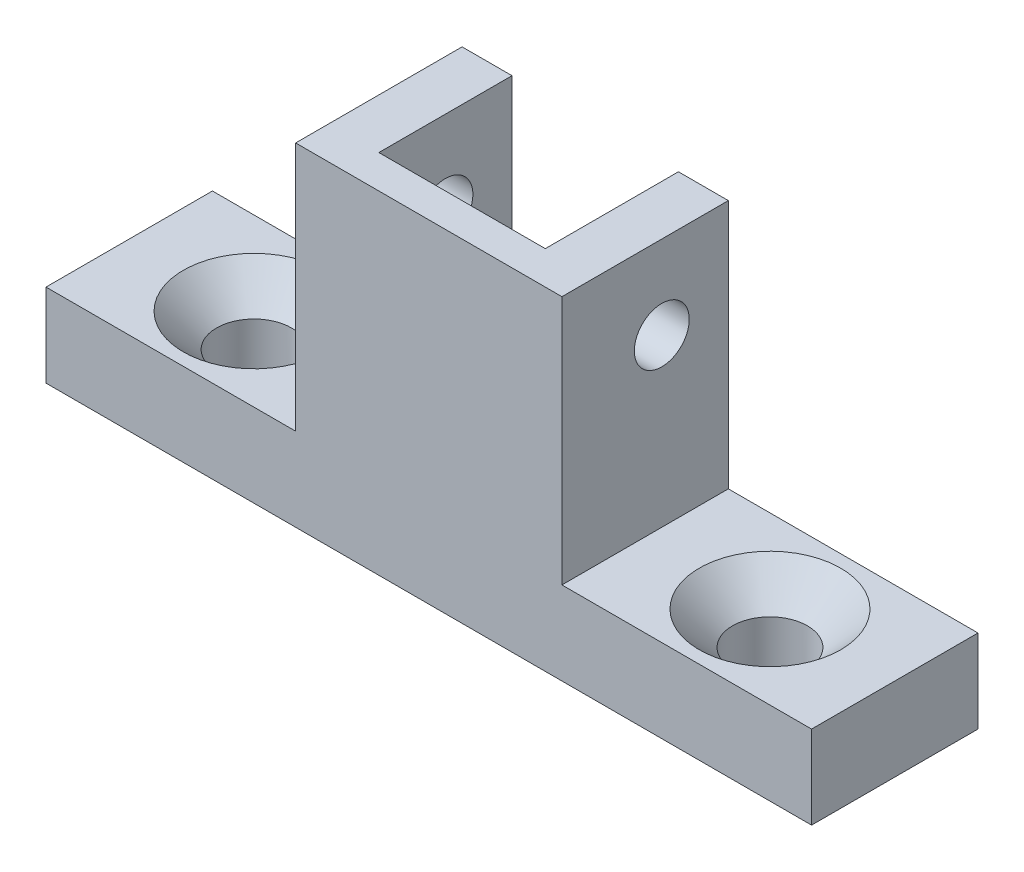
from build123d import *

# Parameters (mm, degrees)
BOSS_EXTRUDE1_DEPTH = 5
SKETCH2_R           = 2.25
CUT_EXTRUDE1_DEPTH  = 28.910571474
CHAMFER1_SIZE       = 2
SKETCH4_W           = 10
SKETCH4_H           = 8
CUT_EXTRUDE3_DEPTH  = 15
SKETCH3_R           = 1.65
CUT_EXTRUDE2_DEPTH  = 35.799425283


with BuildPart() as part:
    # Sketch1 → Boss-Extrude1 (new, symmetric)
    with BuildSketch(Plane.XY):
        Polygon((-23, -15), (23, -15), (23, -10), (8, -10), (8, 5), (-8, 5), (-8, -10), (-23, -10), align=None)
    extrude(amount=BOSS_EXTRUDE1_DEPTH, both=True)

    # Sketch2 → Cut-Extrude1 (cut, through all)
    with BuildSketch(Plane(origin=(0, -10, 0), x_dir=(1, 0, 0), z_dir=(0, 1, 0))):
        with Locations(Location((-15.5, 0, 0), (0, 0, 180))):
            Circle(SKETCH2_R)
        with Locations(Location((15.5, 0, 0), (0, 0, 180))):
            Circle(SKETCH2_R)
    extrude(amount=-CUT_EXTRUDE1_DEPTH, mode=Mode.SUBTRACT)

    # Chamfer1
    chamfer1_edges = [part.edges().sort_by_distance(p)[0] for p in [
        (-13.25, -10, 0),
        (17.75, -10, 0),
    ]]
    chamfer(chamfer1_edges, length=CHAMFER1_SIZE)

    # Sketch4 → Cut-Extrude3 (cut)
    with BuildSketch(Plane(origin=(0, 5, 0), x_dir=(1, 0, 0), z_dir=(0, 1, 0))):
        with Locations((0, 1)):
            Rectangle(SKETCH4_W, SKETCH4_H)
    extrude(amount=-CUT_EXTRUDE3_DEPTH, mode=Mode.SUBTRACT)

    # Sketch3 → Cut-Extrude2 (cut, through all)
    with BuildSketch(Plane(origin=(8, 0, 0), x_dir=(0, 0, -1), z_dir=(1, 0, 0))):
        with Locations(Location((1, 0, 0), (0, 0, 90))):
            Circle(SKETCH3_R)
    extrude(amount=-CUT_EXTRUDE2_DEPTH, mode=Mode.SUBTRACT)


solid = part.part
